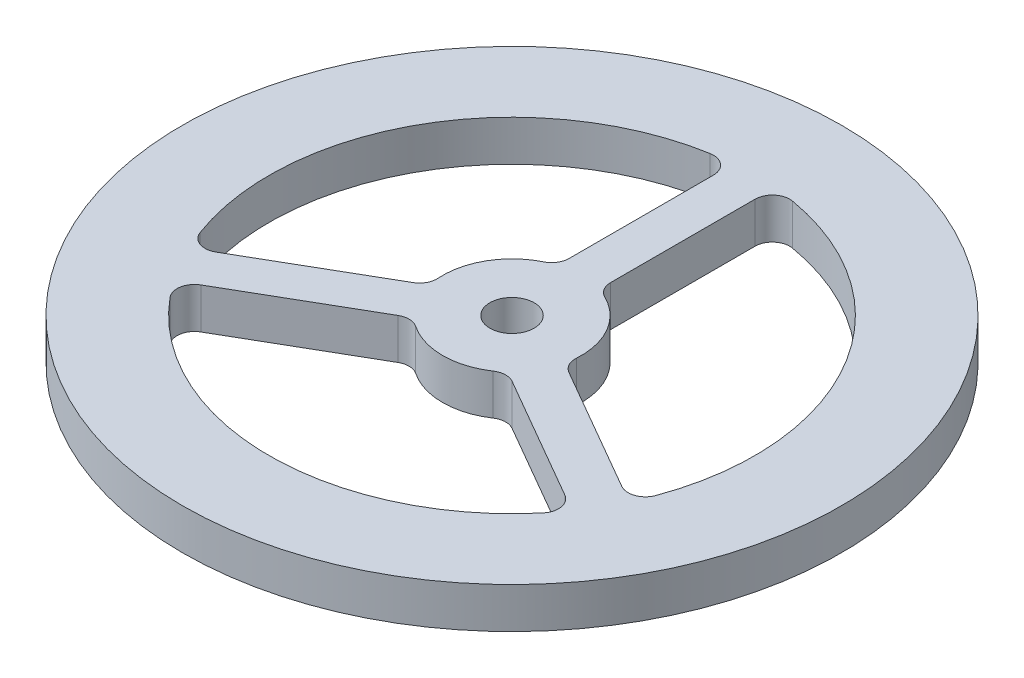
from build123d import *

# Parameters (mm, degrees)
SKETCH1_R           = 38
SKETCH1_R_2         = 2.55
BOSS_EXTRUDE1_DEPTH = 4.7


with BuildPart() as part:
    # Sketch1 → Boss-Extrude1 (new body)
    with BuildSketch(Plane(origin=(0, 0, 0), x_dir=(1, 0, 0), z_dir=(0, 1, 0))):
        with Locations(Location((0, 0, 0), (0, 0, 270))):
            Circle(SKETCH1_R)
        with Locations(Location((0, 0, 0), (0, 0, 270))):
            Circle(SKETCH1_R_2, mode=Mode.SUBTRACT)
        with BuildLine():
            Line((2.4, 8.979977728), (2.4, 25.624987805))
            ThreePointArc((2.4, 25.624987805), (3.110993227, 27.154190714), (4.738461538, 27.596140713))
            ThreePointArc((4.738461538, 27.596140713), (24.248711306, 14), (26.268189673, -9.694442289))
            ThreePointArc((26.268189673, -9.694442289), (25.071715591, -10.882896192), (23.391890411, -10.734032933))
            Line((23.391890411, -10.734032933), (8.976888838, -2.411527895))
            ThreePointArc((8.976888838, -2.411527895), (8.211845562, -1.620020671), (7.98151107, -0.54358167))
            ThreePointArc((7.98151107, -0.54358167), (6.92820323, 4), (3.52, 7.183982183))
            ThreePointArc((3.52, 7.183982183), (2.702943725, 7.921677204), (2.4, 8.979977728))
        make_face(mode=Mode.SUBTRACT)
        with BuildLine():
            Line((-2.4, 8.979977728), (-2.4, 25.624987805))
            ThreePointArc((-2.4, 25.624987805), (-3.110993227, 27.154190714), (-4.738461538, 27.596140713))
            ThreePointArc((-4.738461538, 27.596140713), (-24.248711306, 14), (-26.268189673, -9.694442289))
            ThreePointArc((-26.268189673, -9.694442289), (-25.071715591, -10.882896192), (-23.391890411, -10.734032933))
            Line((-23.391890411, -10.734032933), (-8.976888838, -2.411527895))
            ThreePointArc((-8.976888838, -2.411527895), (-8.211845562, -1.620020671), (-7.98151107, -0.54358167))
            ThreePointArc((-7.98151107, -0.54358167), (-6.92820323, 4), (-3.52, 7.183982183))
            ThreePointArc((-3.52, 7.183982183), (-2.702943725, 7.921677204), (-2.4, 8.979977728))
        make_face(mode=Mode.SUBTRACT)
        with BuildLine():
            Line((6.576888838, -6.568449833), (20.991890411, -14.890954872))
            ThreePointArc((20.991890411, -14.890954872), (21.960722365, -16.271294523), (21.529728135, -17.901698424))
            ThreePointArc((21.529728135, -17.901698424), (0, -28), (-21.529728135, -17.901698424))
            ThreePointArc((-21.529728135, -17.901698424), (-21.960722365, -16.271294523), (-20.991890411, -14.890954872))
            Line((-20.991890411, -14.890954872), (-6.576888838, -6.568449833))
            ThreePointArc((-6.576888838, -6.568449833), (-5.508901837, -6.301656533), (-4.46151107, -6.640400513))
            ThreePointArc((-4.46151107, -6.640400513), (0, -8), (4.46151107, -6.640400513))
            ThreePointArc((4.46151107, -6.640400513), (5.508901837, -6.301656533), (6.576888838, -6.568449833))
        make_face(mode=Mode.SUBTRACT)
    extrude(amount=BOSS_EXTRUDE1_DEPTH)


solid = part.part
